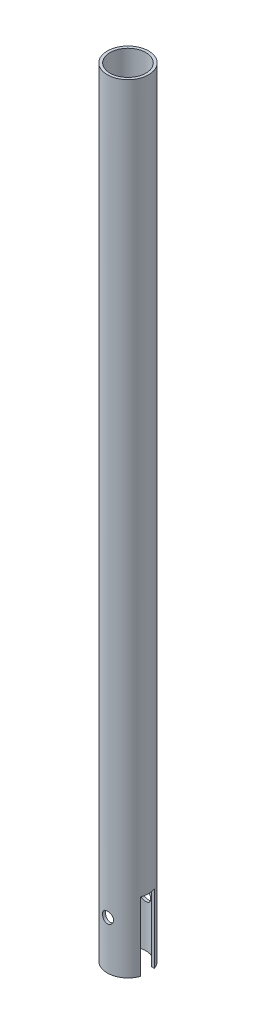
from build123d import *

# Parameters (mm, degrees)
SKETCH1_R               = 15
SKETCH1_R_2             = 13
BOSS_EXTRUDE1_DEPTH     = 282.5
SKETCH3_W               = 10
SKETCH3_H               = 50
CUT_EXTRUDE1_DEPTH      = 282.5
CUT_EXTRUDE2_DEPTH      = 284.29534059
CUT_EXTRUDE2_DEPTH_BACK = 284.29534059
SKETCH4_R               = 4


with BuildPart() as part:
    # Sketch1 → Boss-Extrude1 (new, symmetric)
    with BuildSketch(Plane(origin=(0, 0, 0), x_dir=(1, 0, 0), z_dir=(0, 1, 0))):
        with Locations(Location((0, 0, 0), (0, 0, 270))):
            Circle(SKETCH1_R)
        with Locations(Location((0, 0, 0), (0, 0, 270))):
            Circle(SKETCH1_R_2, mode=Mode.SUBTRACT)
    extrude(amount=BOSS_EXTRUDE1_DEPTH, both=True)

    # Sketch3 → Cut-Extrude1 (cut, symmetric)
    with BuildSketch(Plane(origin=(0, 0, 0), x_dir=(0, 0, -1), z_dir=(1, 0, 0))):
        with Locations((0, -257.5)):
            Rectangle(SKETCH3_W, SKETCH3_H)
    extrude(amount=CUT_EXTRUDE1_DEPTH, both=True, mode=Mode.SUBTRACT)

    # Sketch4 → Cut-Extrude2 (cut, two sides: drawn at the far end of the back side and taken through both)
    with BuildSketch(Plane.XY.offset(-CUT_EXTRUDE2_DEPTH_BACK)):
        with Locations((0, -247.5)):
            Circle(SKETCH4_R)
    extrude(amount=CUT_EXTRUDE2_DEPTH + CUT_EXTRUDE2_DEPTH_BACK, mode=Mode.SUBTRACT)


solid = part.part
